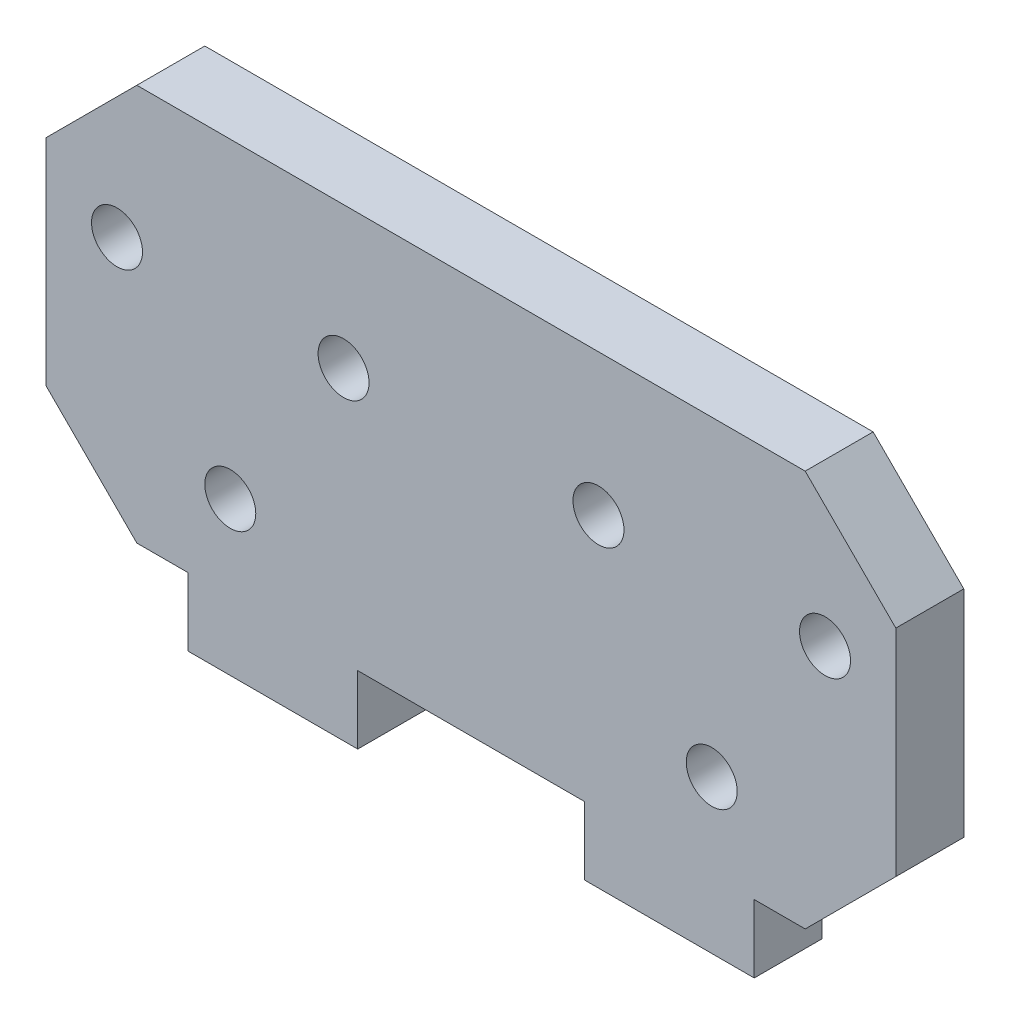
from build123d import *

# Parameters (mm, degrees)
CROQUIS1_W                   = 75
CROQUIS1_H                   = 35
CROQUIS1_R                   = 2.25
SALIENTE_EXTRUIR1_DEPTH      = 3
TALADRO_DE_MARGEN_PARA_M41_D = 4.5
CROQUIS6_W                   = 15
CROQUIS6_H                   = 6
SALIENTE_EXTRUIR2_DEPTH      = 6
CHAFL_N1_SIZE                = 8


with BuildPart() as part:
    # Croquis1 → Saliente-Extruir1 (new, symmetric)
    with BuildSketch(Plane.XY):
        Rectangle(CROQUIS1_W, CROQUIS1_H)
        with Locations((-11.25, 5)):
            Circle(CROQUIS1_R, mode=Mode.SUBTRACT)
    extrude(amount=SALIENTE_EXTRUIR1_DEPTH, both=True)

    # Taladro de margen para M41 (through all)
    with Locations(Plane.XY.offset(3)):
        with Locations((-31.25, 5), (31.25, 5), (11.25, 5), (-21.25, -10), (21.25, -10)):
            Hole(TALADRO_DE_MARGEN_PARA_M41_D / 2)

    # Croquis6 → Saliente-Extruir2 (add, through all)
    with BuildSketch(Plane.XY.offset(3)):
        with Locations((-17.5, -20.5)):
            Rectangle(CROQUIS6_W, CROQUIS6_H)
        with Locations((17.5, -20.5)):
            Rectangle(CROQUIS6_W, CROQUIS6_H)
    extrude(amount=-SALIENTE_EXTRUIR2_DEPTH)

    # Chaflán1
    chafl_n1_edges = [part.edges().sort_by_distance(p)[0] for p in [
        (-37.5, 17.5, 0),
        (37.5, 17.5, 0),
        (37.5, -17.5, 0),
        (-37.5, -17.5, 0),
    ]]
    chamfer(chafl_n1_edges, length=CHAFL_N1_SIZE)


solid = part.part
